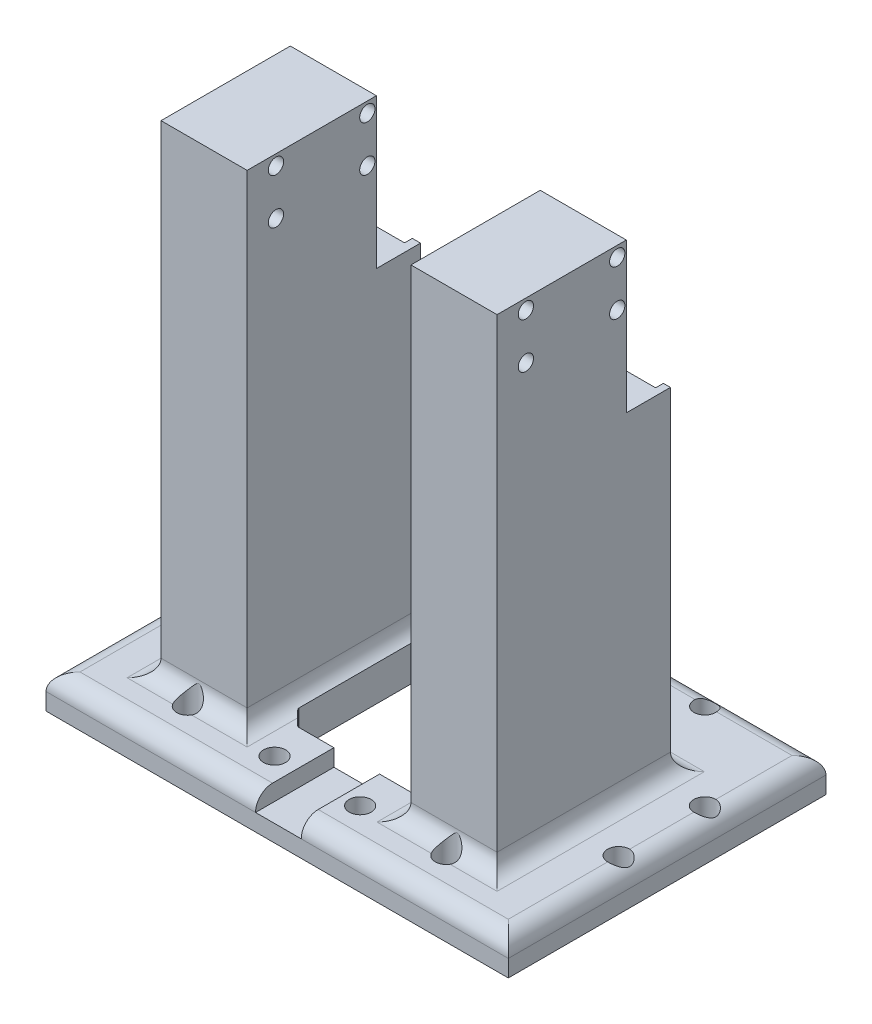
from build123d import *

# Parameters (mm, degrees)
BOSS_EXTRUDE1_DEPTH = 10
SKETCH2_W           = 25.382455423
SKETCH2_H           = 51.1096
SKETCH2_W_2         = 25.382455424
BOSS_EXTRUDE2_DEPTH = 142.23205499
SKETCH3_W           = 20.539655047
SKETCH3_H           = 123.846095538
CUT_EXTRUDE1_DEPTH  = 5.5
CUT_EXTRUDE2_START  = -7.5
SKETCH4_W           = 25.382455423
SKETCH4_H           = 46.86426915
CUT_EXTRUDE2_DEPTH  = 20
FILLET14_R          = 5
SKETCH5_R           = 1.6
CUT_EXTRUDE3_DEPTH  = 5
CUT_EXTRUDE4_DEPTH  = 4780.63634221
SKETCH7_W           = 13.464106431
SKETCH7_H           = 23.097275307
CUT_EXTRUDE5_DEPTH  = 5
SKETCH8_R           = 3.25
SKETCH8_R_2         = 3.175
CUT_EXTRUDE6_DEPTH  = 4780.63634221
SKETCH14_R          = 2.25
CUT_EXTRUDE7_DEPTH  = 5618.07506486
SKETCH18_W          = 25.382455424
SKETCH18_H          = 44.127016755
CUT_EXTRUDE10_DEPTH = 7373.486332976
SKETCH19_W          = 20.539655047
SKETCH19_H          = 13.385959452
CUT_EXTRUDE11_DEPTH = 5.5
SKETCH20_W          = 20.539655046
SKETCH20_H          = 13.385959452
CUT_EXTRUDE12_DEPTH = 5.5
BOSS_EXTRUDE3_START = 3.2069
SKETCH21_W          = 20.539655046
SKETCH21_H          = 93.105038235
SKETCH21_R          = 1.6
SKETCH21_W_2        = 20.539655047
BOSS_EXTRUDE3_DEPTH = 3.2069


with BuildPart() as part:
    # Sketch1 → Boss-Extrude1 (new body)
    with BuildSketch(Plane(origin=(4645.495048978, -5615.45116431, 222.286965694), x_dir=(1, 0, 0), z_dir=(0, 1, 0))):
        Polygon((-5.003976971, 249.919022988), (131.260480305, 249.919022988), (131.260480305, 156.290157663), (63.128251667, 156.290157663), (-5.003976971, 156.290157663), align=None)
    extrude(amount=BOSS_EXTRUDE1_DEPTH)

    # Sketch2 → Boss-Extrude2 (add)
    with BuildSketch(Plane(origin=(0, -5605.45116431, 0), x_dir=(1, 0, 0), z_dir=(0, 1, 0))):
        with Locations((4671.612442409, -24.983310101)):
            Rectangle(SKETCH2_W, SKETCH2_H)
        with Locations((4745.285596868, -24.983310101)):
            Rectangle(SKETCH2_W_2, SKETCH2_H)
    extrude(amount=BOSS_EXTRUDE2_DEPTH)

    # Sketch3 → Cut-Extrude1 (cut)
    with BuildSketch(Plane(origin=(0, 0, -0.571489899), x_dir=(-1, 0, 0), z_dir=(0, 0, -1))):
        with Locations((-4671.612442409, -5525.142157089)):
            Rectangle(SKETCH3_W, SKETCH3_H)
    cut_extrude1 = extrude(amount=-CUT_EXTRUDE1_DEPTH, mode=Mode.SUBTRACT)

    # Sketch4 → Cut-Extrude2 (cut)
    with BuildSketch(Plane(origin=(0, 0, 4.928510101), x_dir=(-1, 0, 0), z_dir=(0, 0, -1)).offset(CUT_EXTRUDE2_START)):
        with Locations((-4671.612442409, -5483.9139915)):
            Rectangle(SKETCH4_W, SKETCH4_H)
    cut_extrude2 = extrude(amount=CUT_EXTRUDE2_DEPTH, mode=Mode.SUBTRACT)

    # Fillet14
    fillet14_edges = [part.edges().sort_by_distance(p)[0] for p in [
        (4776.755529283, -5605.45116431, 19.182375368),
        (4658.921214697, -5605.45116431, 24.983310101),
        (4671.612442409, -5605.45116431, 50.538110101),
        (4684.30367012, -5605.45116431, 24.983310101),
        (4671.612442409, -5605.45116431, -0.571489899),
        (4708.623300645, -5605.45116431, -27.632057294),
        (4745.285596868, -5605.45116431, 50.538110101),
        (4757.97682458, -5605.45116431, 24.983310101),
        (4745.285596868, -5605.45116431, -0.571489899),
        (4732.594369156, -5605.45116431, 24.983310101),
        (4640.491072008, -5605.45116431, 19.182375368),
        (4708.623300645, -5605.45116431, 65.99680803),
    ]]
    fillet(fillet14_edges, radius=FILLET14_R)

    # Mirror1: Cut-Extrude1, Cut-Extrude2 across plane
    add(cut_extrude1.mirror(Plane.ZY.offset(-4708.623300645)), mode=Mode.SUBTRACT)
    add(cut_extrude2.mirror(Plane.ZY.offset(-4708.623300645)), mode=Mode.SUBTRACT)

    # Sketch5 → Cut-Extrude3 (cut)
    with BuildSketch(Plane(origin=(0, 0, 4.928510101), x_dir=(-1, 0, 0), z_dir=(0, 0, -1))):
        with Locations((-4671.842770313, -5574.737228853)):
            Circle(SKETCH5_R)
        with Locations((-4671.842770313, -5528.735999288)):
            Circle(SKETCH5_R)
        with Locations((-4745.017438635, -5574.737228853)):
            Circle(SKETCH5_R)
        with Locations((-4745.017438635, -5528.628482111)):
            Circle(SKETCH5_R)
    extrude(amount=-CUT_EXTRUDE3_DEPTH, mode=Mode.SUBTRACT)

    # Sketch6 → Cut-Extrude4 (cut, through all)
    with BuildSketch(Plane.XZ.offset(5615.45116431)):
        Polygon((4687.348070312, 38.150077354), (4687.348070312, 5.450659802), (4687.35442981, 5.323724065), (4687.372597929, 5.20226789), (4687.422135931, 5.02329467), (4687.444743306, 4.964651843), (4687.508601213, 4.832615857), (4687.571319699, 4.731484473), (4687.638876699, 4.641907758), (4687.7200447, 4.55263419), (4687.84495356, 4.42772533), (4691.137669473, 1.135009417), (4691.222399526, 1.051088855), (4691.251476138, 1.024546074), (4691.295529708, 0.987314905), (4691.359214955, 0.939150756), (4691.428077295, 0.893681536), (4691.523234947, 0.840680623), (4691.610896759, 0.796669555), (4691.843979056, 0.730334118), (4691.884577033, 0.722897964), (4692.093061536, 0.705668578), (4724.792479088, 0.705668578), (4724.936110559, 0.713816764), (4725.026777643, 0.727468199), (4725.101046112, 0.743724427), (4725.164345426, 0.761331135), (4725.264560971, 0.796669555), (4725.334243605, 0.827021022), (4725.395301554, 0.855819264), (4725.449934311, 0.878448893), (4725.496717591, 0.91881091), (4725.526325669, 0.939150756), (4729.165495924, 4.55263419), (4729.262148578, 4.661030049), (4729.298502432, 4.709125738), (4729.326565722, 4.749791118), (4729.346961215, 4.781631111), (4729.37122739, 4.822471683), (4729.397149732, 4.870380208), (4729.444119009, 4.957186745), (4729.461198306, 5.017169921), (4729.47550035, 5.058788106), (4729.495955769, 5.128598501), (4729.516316716, 5.198086482), (4729.519733382, 5.239148092), (4729.54334852, 5.450659802), (4729.537470312, 38.09014721), (4729.54334852, 38.150077354), (4729.534899388, 38.230845781), (4729.501521643, 38.477460317), (4729.37122739, 38.790523015), (4729.27532586, 38.922817446), (4729.17639288, 39.059293709), (4725.6905047, 42.52309419), (4725.551264329, 42.643471719), (4725.437264032, 42.728410325), (4725.125631636, 42.85749269), (4724.792479088, 42.909521887), (4692.174176963, 42.895068579), (4691.758430152, 42.864627364), (4691.454752306, 42.738839882), (4691.182501853, 42.536436032), (4687.7200447, 39.048102966), (4687.49735901, 38.790523015), (4687.372597929, 38.48932312), align=None)
    extrude(amount=-CUT_EXTRUDE4_DEPTH, mode=Mode.SUBTRACT)

    # Sketch7 → Cut-Extrude5 (cut)
    with BuildSketch(Plane(origin=(0, -5605.45116431, 0), x_dir=(1, 0, 0), z_dir=(0, 1, 0))):
        with Locations((4708.980933984, -54.448170377)):
            Rectangle(SKETCH7_W, SKETCH7_H)
    extrude(amount=-CUT_EXTRUDE5_DEPTH, mode=Mode.SUBTRACT)

    # Sketch8 → Cut-Extrude6 (cut, through all)
    with BuildSketch(Plane.XZ.offset(5615.45116431)):
        with Locations(Location((4670.149923356, 53.863765694, 0), (0, 0, 270))):
            Circle(SKETCH8_R)
        with Locations(Location((4746.349923356, 53.863765694, 0), (0, 0, 270))):
            Circle(SKETCH8_R)
        with Locations(Location((4720.949923356, 53.863765694, 0), (0, 0, 270))):
            Circle(SKETCH8_R)
        with Locations(Location((4670.149923356, -22.336234306, 0), (0, 0, 270))):
            Circle(SKETCH8_R)
        with Locations(Location((4695.671922686, 53.814156415, 0), (0, 0, 270))):
            Circle(SKETCH8_R)
        with Locations(Location((4695.549923356, -22.336234306, 0), (0, 0, 270))):
            Circle(SKETCH8_R)
        with Locations(Location((4720.949923356, -22.336234306, 0), (0, 0, 270))):
            Circle(SKETCH8_R)
        with Locations(Location((4746.349923356, -22.336234306, 0), (0, 0, 270))):
            Circle(SKETCH8_R_2)
        with Locations(Location((4771.749923356, 28.463765694, 0), (0, 0, 270))):
            Circle(SKETCH8_R)
        with Locations(Location((4771.749923356, 3.063765694, 0), (0, 0, 270))):
            Circle(SKETCH8_R)
        with Locations(Location((4644.749923356, 3.063765694, 0), (0, 0, 270))):
            Circle(SKETCH8_R)
        with Locations(Location((4644.749923356, 28.463765694, 0), (0, 0, 270))):
            Circle(SKETCH8_R)
    extrude(amount=-CUT_EXTRUDE6_DEPTH, mode=Mode.SUBTRACT)

    # Sketch14 → Cut-Extrude7 (cut, through all)
    with BuildSketch(Plane.ZY.offset(-4658.921214697)):
        with Locations((15.110858619, -5466.325470091)):
            Circle(SKETCH14_R)
        with Locations((15.110858619, -5479.725076471)):
            Circle(SKETCH14_R)
        with Locations((42.039251188, -5479.725076471)):
            Circle(SKETCH14_R)
        with Locations((42.039251188, -5466.325470091)):
            Circle(SKETCH14_R)
    extrude(amount=-CUT_EXTRUDE7_DEPTH, mode=Mode.SUBTRACT)

    # Sketch18 → Cut-Extrude10 (cut, through all)
    with BuildSketch(Plane(origin=(0, 0, 12.428510101), x_dir=(-1, 0, 0), z_dir=(0, 0, -1))):
        with Locations((-4745.285596868, -5485.282617697)):
            Rectangle(SKETCH18_W, SKETCH18_H)
    extrude(amount=CUT_EXTRUDE10_DEPTH, mode=Mode.SUBTRACT)

    # Sketch19 → Cut-Extrude11 (cut)
    with BuildSketch(Plane(origin=(0, 0, -0.571489899), x_dir=(-1, 0, 0), z_dir=(0, 0, -1))):
        with Locations((-4671.612442409, -5593.758184584)):
            Rectangle(SKETCH19_W, SKETCH19_H)
    extrude(amount=-CUT_EXTRUDE11_DEPTH, mode=Mode.SUBTRACT)

    # Sketch20 → Cut-Extrude12 (cut)
    with BuildSketch(Plane(origin=(0, 0, -0.571489899), x_dir=(-1, 0, 0), z_dir=(0, 0, -1))):
        with Locations((-4745.634158882, -5593.758184584)):
            Rectangle(SKETCH20_W, SKETCH20_H)
    extrude(amount=-CUT_EXTRUDE12_DEPTH, mode=Mode.SUBTRACT)

    # Sketch21 → Boss-Extrude3 (add)
    # profile 1 of 2: a face of its own
    with BuildSketch(Plane(origin=(0, 0, 4.928510101), x_dir=(-1, 0, 0), z_dir=(0, 0, -1)).offset(BOSS_EXTRUDE3_START)):
        with Locations((-4745.634158882, -5553.898645193)):
            Rectangle(SKETCH21_W, SKETCH21_H)
        with Locations((-4745.017438635, -5574.737228853)):
            Circle(SKETCH21_R, mode=Mode.SUBTRACT)
        with Locations((-4745.017438635, -5528.628482111)):
            Circle(SKETCH21_R, mode=Mode.SUBTRACT)
    # profile 2 of 2: a face of its own
    with BuildSketch(Plane(origin=(0, 0, 4.928510101), x_dir=(-1, 0, 0), z_dir=(0, 0, -1)).offset(BOSS_EXTRUDE3_START)):
        with Locations((-4671.612442409, -5553.898645193)):
            Rectangle(SKETCH21_W_2, SKETCH21_H)
        with Locations((-4671.842770313, -5574.737228853)):
            Circle(SKETCH21_R, mode=Mode.SUBTRACT)
        with Locations((-4671.842770313, -5528.735999288)):
            Circle(SKETCH21_R, mode=Mode.SUBTRACT)
    extrude(amount=-BOSS_EXTRUDE3_DEPTH)


solid = part.part
